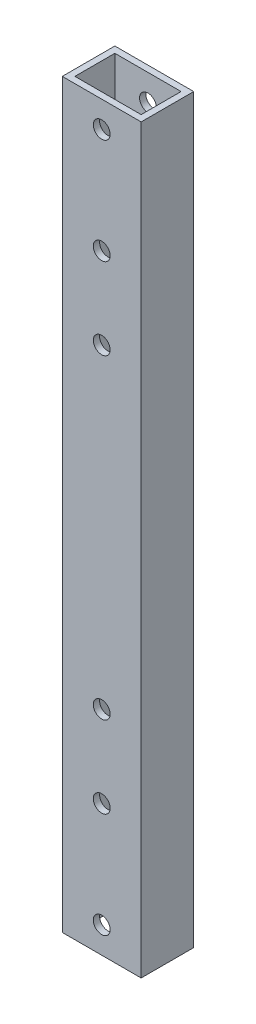
from build123d import *

# Parameters (mm, degrees)
SKETCH_1_W          = 15
SKETCH_1_H          = 10
SKETCH_1_W_2        = 12.6
SKETCH_1_H_2        = 7.6
EXTRUDE_1_DEPTH     = 70.5
SKETCH_2_R          = 1.6
CUT_EXTRUDE_1_DEPTH = 100


with BuildPart() as part:
    # ｽｹｯﾁ1 → ﾎﾞｽ - 押し出し1 (new, symmetric)
    with BuildSketch(Plane(origin=(0, 0, 0), x_dir=(1, 0, 0), z_dir=(0, 1, 0))):
        Rectangle(SKETCH_1_W, SKETCH_1_H)
        Rectangle(SKETCH_1_W_2, SKETCH_1_H_2, mode=Mode.SUBTRACT)
    extrude(amount=EXTRUDE_1_DEPTH, both=True)

    # ｽｹｯﾁ2 → ｶｯﾄ - 押し出し1 (cut)
    with BuildSketch(Plane(origin=(0, 0, -5), x_dir=(-1, 0, 0), z_dir=(0, 0, -1))):
        with Locations((0, -65.5)):
            Circle(SKETCH_2_R)
        with Locations((0, -45.5)):
            Circle(SKETCH_2_R)
        with Locations(Location((0, 45.5, 0), (0, 0, 180))):
            Circle(SKETCH_2_R)
        with Locations(Location((0, 65.5, 0), (0, 0, 180))):
            Circle(SKETCH_2_R)
        with Locations((0, -30)):
            Circle(SKETCH_2_R)
        with Locations(Location((0, 30, 0), (0, 0, 180))):
            Circle(SKETCH_2_R)
    extrude(amount=-CUT_EXTRUDE_1_DEPTH, mode=Mode.SUBTRACT)


solid = part.part
